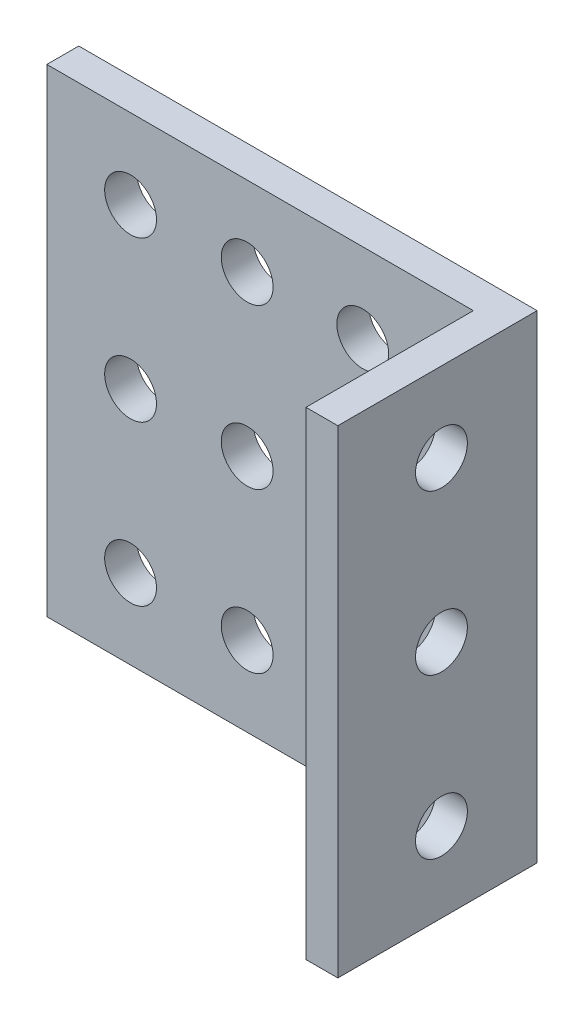
from build123d import *

# Parameters (mm, degrees)
SKETCH_1_W             = 230
SKETCH_1_H             = 240
EXTRUDE_1_DEPTH        = 16
SKETCH_3_R             = 13
CUT_EXTRUDE_1_DEPTH    = 167.976046186
PATTERN_LINEAR_1_COUNT = 3
PATTERN_LINEAR_1_PITCH = 80
SKETCH_4_W             = 16
SKETCH_4_H             = 240
EXTRUDE_2_DEPTH        = 84
SKETCH_5_R             = 13
CUT_EXTRUDE_2_DEPTH    = 265.945277369
PATTERN_LINEAR_2_COUNT = 3
PATTERN_LINEAR_2_PITCH = 80


with BuildPart() as part:
    # 草图1 → 凸台-拉伸1 (new body)
    with BuildSketch(Plane.XY):
        Rectangle(SKETCH_1_W, SKETCH_1_H)
    extrude(amount=EXTRUDE_1_DEPTH)

    # 草图3 → 切除-拉伸1 (cut, through all)
    with BuildSketch(Plane.XY.offset(16)):
        with Locations((-73, 80)):
            Circle(SKETCH_3_R)
        with Locations((-14.5, 80)):
            Circle(SKETCH_3_R)
        with Locations((43.5, 80)):
            Circle(SKETCH_3_R)
    cut_extrude_1 = extrude(amount=-CUT_EXTRUDE_1_DEPTH, mode=Mode.SUBTRACT)

    # 阵列(线性)1: 切除-拉伸1 ×3
    with Locations(*[(0, -i * PATTERN_LINEAR_1_PITCH, 0) for i in range(1, PATTERN_LINEAR_1_COUNT)]):
        add(cut_extrude_1, mode=Mode.SUBTRACT)

    # 草图4 → 凸台-拉伸2 (add)
    with BuildSketch(Plane.XY.offset(16)):
        with Locations((107, 0)):
            Rectangle(SKETCH_4_W, SKETCH_4_H)
    extrude(amount=EXTRUDE_2_DEPTH)

    # 草图5 → 切除-拉伸2 (cut, through all)
    with BuildSketch(Plane.ZY.offset(-99)):
        with Locations((48, 80)):
            Circle(SKETCH_5_R)
    cut_extrude_2 = extrude(amount=-CUT_EXTRUDE_2_DEPTH, mode=Mode.SUBTRACT)

    # 阵列(线性)2: 切除-拉伸2 ×3
    with Locations(*[(0, -i * PATTERN_LINEAR_2_PITCH, 0) for i in range(1, PATTERN_LINEAR_2_COUNT)]):
        add(cut_extrude_2, mode=Mode.SUBTRACT)


solid = part.part
